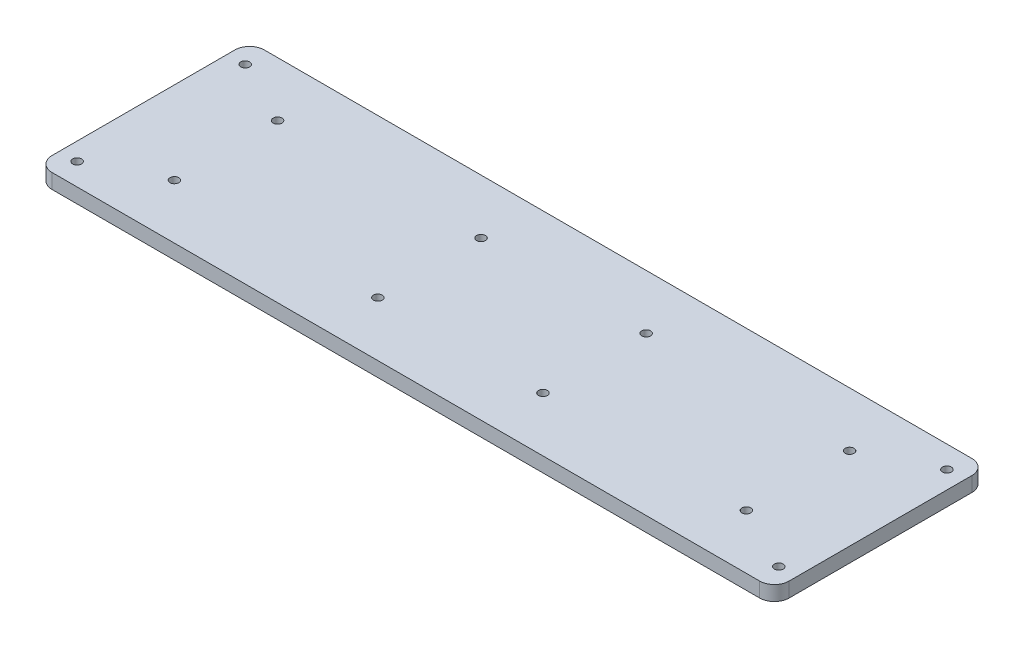
from build123d import *

# Parameters (mm, degrees)
SKETCH1_W           = 250
SKETCH1_H           = 72
SKETCH1_R           = 1.5
BOSS_EXTRUDE1_DEPTH = 5
FILLET1_R           = 5


with BuildPart() as part:
    # Sketch1 → Boss-Extrude1 (new body)
    with BuildSketch(Plane(origin=(0, 0, 0), x_dir=(1, 0, 0), z_dir=(0, 1, 0))):
        Rectangle(SKETCH1_W, SKETCH1_H)
        with Locations(Location((-119, -28.5, 0), (0, 0, 270))):
            Circle(SKETCH1_R, mode=Mode.SUBTRACT)
        with Locations(Location((119, -28.5, 0), (0, 0, 90))):
            Circle(SKETCH1_R, mode=Mode.SUBTRACT)
        with Locations(Location((119, 28.5, 0), (0, 0, 270))):
            Circle(SKETCH1_R, mode=Mode.SUBTRACT)
        with Locations(Location((-119, 28.5, 0), (0, 0, 90))):
            Circle(SKETCH1_R, mode=Mode.SUBTRACT)
        with Locations(Location((-97, 17.5, 0), (0, 0, 270))):
            Circle(SKETCH1_R, mode=Mode.SUBTRACT)
        with Locations(Location((-97, -17.5, 0), (0, 0, 90))):
            Circle(SKETCH1_R, mode=Mode.SUBTRACT)
        with Locations(Location((-28, 17.5, 0), (0, 0, 90))):
            Circle(SKETCH1_R, mode=Mode.SUBTRACT)
        with Locations(Location((-28, -17.5, 0), (0, 0, 270))):
            Circle(SKETCH1_R, mode=Mode.SUBTRACT)
        with Locations(Location((97, 17.5, 0), (0, 0, 90))):
            Circle(SKETCH1_R, mode=Mode.SUBTRACT)
        with Locations(Location((97, -17.5, 0), (0, 0, 270))):
            Circle(SKETCH1_R, mode=Mode.SUBTRACT)
        with Locations(Location((28, -17.5, 0), (0, 0, 90))):
            Circle(SKETCH1_R, mode=Mode.SUBTRACT)
        with Locations(Location((28, 17.5, 0), (0, 0, 270))):
            Circle(SKETCH1_R, mode=Mode.SUBTRACT)
    extrude(amount=BOSS_EXTRUDE1_DEPTH)

    # Fillet1
    fillet1_edges = [part.edges().sort_by_distance(p)[0] for p in [
        (-125, 2.5, -36),
        (125, 2.5, -36),
        (125, 2.5, 36),
        (-125, 2.5, 36),
    ]]
    fillet(fillet1_edges, radius=FILLET1_R)


solid = part.part
